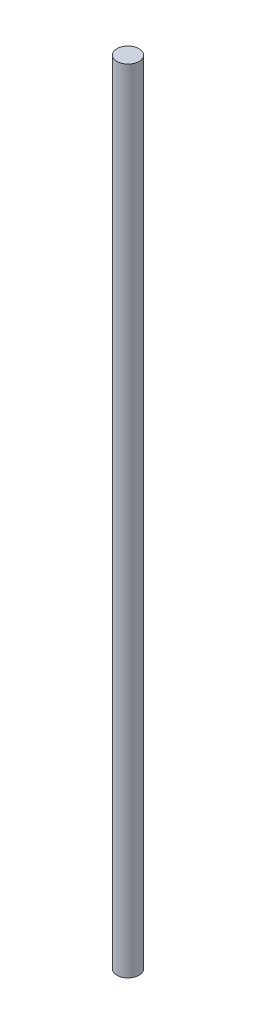
from build123d import *

# Parameters (mm, degrees)
SKETCH1_R           = 5
BOSS_EXTRUDE1_DEPTH = 357.66


with BuildPart() as part:
    # Sketch1 → Boss-Extrude1 (new body)
    with BuildSketch(Plane(origin=(0, 0, 0), x_dir=(1, 0, 0), z_dir=(0, 1, 0))):
        with Locations(Location((0, 0, 0), (0, 0, 270))):
            Circle(SKETCH1_R)
    extrude(amount=BOSS_EXTRUDE1_DEPTH)


solid = part.part
